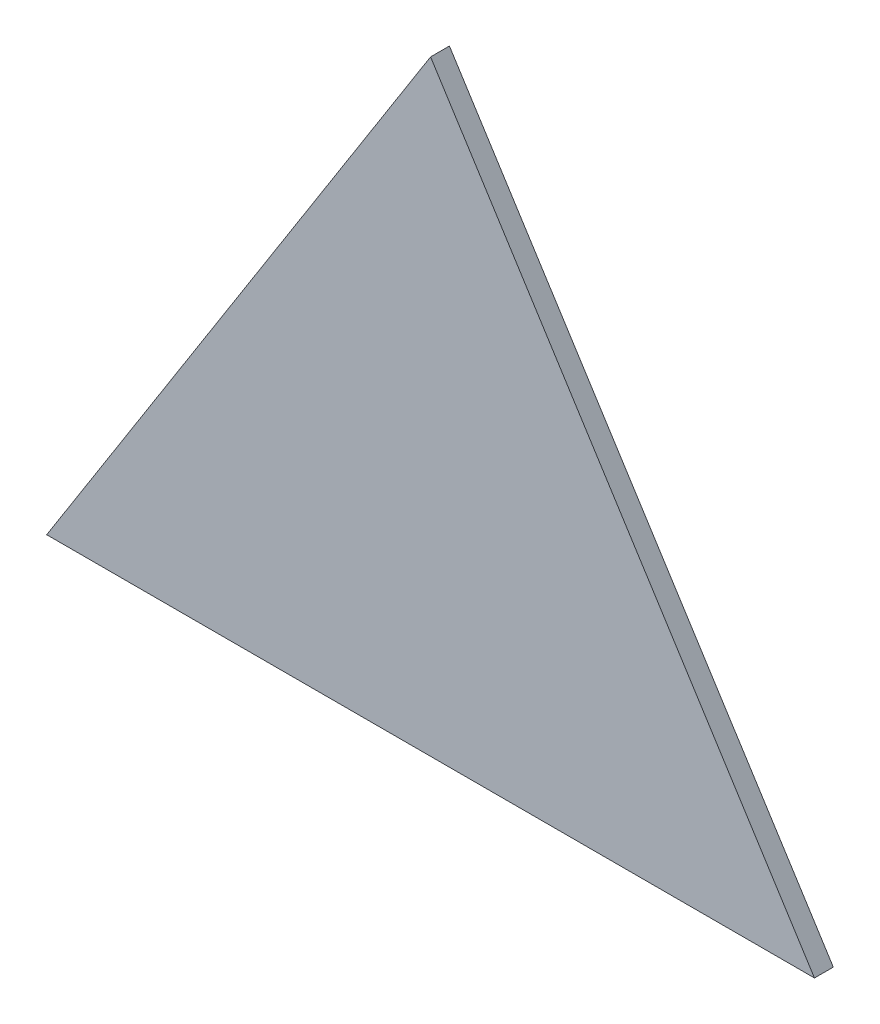
from build123d import *

# Parameters (mm, degrees)
BOSS_EXTRUDE1_DEPTH = 0.5


with BuildPart() as part:
    # Sketch1 → Boss-Extrude1 (new body)
    with BuildSketch(Plane.XY):
        Polygon((214.8510188, -133.939809577), (204.657179454, -117.853993789), (194.463340109, -133.939809577), align=None)
    extrude(amount=BOSS_EXTRUDE1_DEPTH)


solid = part.part
